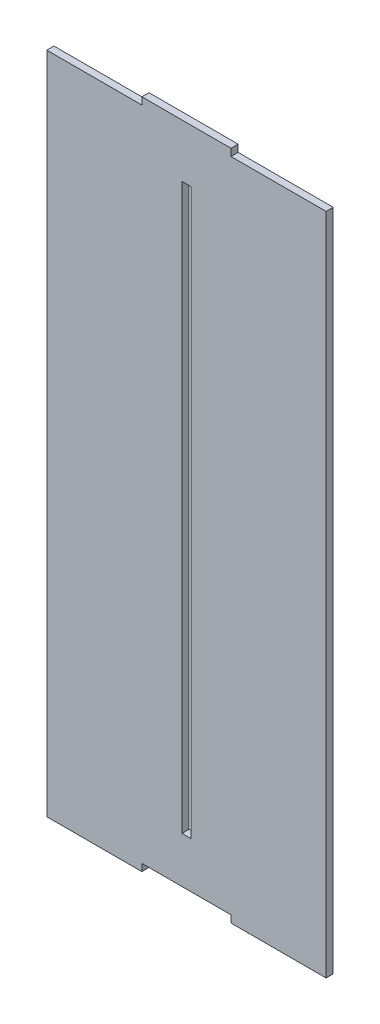
from build123d import *

# Parameters (mm, degrees)
ESBO_O1_W                = 7.5
ESBO_O1_H                = 475
RESSALTO_EXTRUS_O1_DEPTH = 6


with BuildPart() as part:
    # Esboço1 → Ressalto-extrusão1 (new body)
    with BuildSketch(Plane.XY):
        Polygon((155, 0), (235, 0), (235, 558.5), (155, 558.5), (155, 564.5), (80, 564.5), (80, 558.5), (0, 558.5), (0, 0), (80, 0), (80, 6), (155, 6), align=None)
        with Locations((117.5, 282.25)):
            Rectangle(ESBO_O1_W, ESBO_O1_H, mode=Mode.SUBTRACT)
    extrude(amount=RESSALTO_EXTRUS_O1_DEPTH)


solid = part.part
